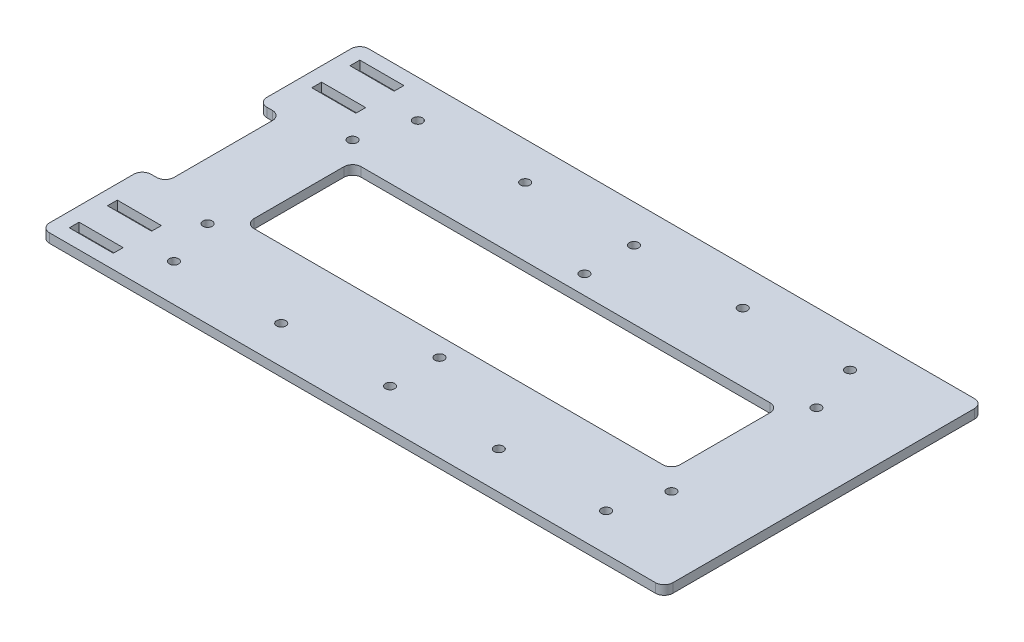
from build123d import *

# Parameters (mm, degrees)
SKETCH1_W           = 215
SKETCH1_H           = 110
BOSS_EXTRUDE1_DEPTH = 3.175
SKETCH2_W           = 147
SKETCH2_H           = 37
CUT_EXTRUDE1_DEPTH  = 121.79458028
SKETCH3_W           = 7.9
SKETCH3_H           = 40
CUT_EXTRUDE2_DEPTH  = 121.79458028
SKETCH5_R           = 1.6
CUT_EXTRUDE4_DEPTH  = 121.79458028
SKETCH6_R           = 1.6
CUT_EXTRUDE5_DEPTH  = 121.79458028
CUT_EXTRUDE6_DEPTH  = 121.79458028
FILLET1_R           = 3


with BuildPart() as part:
    # Sketch1 → Boss-Extrude1 (new body)
    with BuildSketch(Plane(origin=(0, 0, 0), x_dir=(1, 0, 0), z_dir=(0, 1, 0))):
        Rectangle(SKETCH1_W, SKETCH1_H)
    extrude(amount=BOSS_EXTRUDE1_DEPTH)

    # Sketch2 → Cut-Extrude1 (cut, through all)
    with BuildSketch(Plane.XZ):
        Rectangle(SKETCH2_W, SKETCH2_H)
    extrude(amount=-CUT_EXTRUDE1_DEPTH, mode=Mode.SUBTRACT)

    # Sketch3 → Cut-Extrude2 (cut, through all)
    with BuildSketch(Plane(origin=(0, 3.175, 0), x_dir=(1, 0, 0), z_dir=(0, 1, 0))):
        with Locations((-103.55, 0)):
            Rectangle(SKETCH3_W, SKETCH3_H)
    extrude(amount=-CUT_EXTRUDE2_DEPTH, mode=Mode.SUBTRACT)

    # Sketch5 → Cut-Extrude4 (cut, through all)
    with BuildSketch(Plane(origin=(0, 3.175, 0), x_dir=(1, 0, 0), z_dir=(0, 1, 0))):
        with Locations(Location((80, 25, 0), (0, 0, 270))):
            Circle(SKETCH5_R)
        with Locations(Location((80, -25, 0), (0, 0, 270))):
            Circle(SKETCH5_R)
        with Locations(Location((0, 25, 0), (0, 0, 270))):
            Circle(SKETCH5_R)
        with Locations(Location((0, -25, 0), (0, 0, 270))):
            Circle(SKETCH5_R)
        with Locations(Location((-80, 25, 0), (0, 0, 270))):
            Circle(SKETCH5_R)
        with Locations(Location((-80, -25, 0), (0, 0, 270))):
            Circle(SKETCH5_R)
    extrude(amount=-CUT_EXTRUDE4_DEPTH, mode=Mode.SUBTRACT)

    # Sketch6 → Cut-Extrude5 (cut, through all)
    with BuildSketch(Plane(origin=(0, 3.175, 0), x_dir=(1, 0, 0), z_dir=(0, 1, 0))):
        with Locations(Location((-74.528255169, -42.068885296, 0), (0, 0, 270))):
            Circle(SKETCH6_R)
        with Locations(Location((-37.528255169, -42.068885296, 0), (0, 0, 270))):
            Circle(SKETCH6_R)
        with Locations(Location((0, -42.068885296, 0), (0, 0, 270))):
            Circle(SKETCH6_R)
        with Locations(Location((37.528255169, -42.068885296, 0), (0, 0, 90))):
            Circle(SKETCH6_R)
        with Locations(Location((74.528255169, -42.068885296, 0), (0, 0, 90))):
            Circle(SKETCH6_R)
        with Locations(Location((74.528255169, 42.068885296, 0), (0, 0, 270))):
            Circle(SKETCH6_R)
        with Locations(Location((37.528255169, 42.068885296, 0), (0, 0, 270))):
            Circle(SKETCH6_R)
        with Locations(Location((0, 42.068885296, 0), (0, 0, 90))):
            Circle(SKETCH6_R)
        with Locations(Location((-37.528255169, 42.068885296, 0), (0, 0, 90))):
            Circle(SKETCH6_R)
        with Locations(Location((-74.528255169, 42.068885296, 0), (0, 0, 90))):
            Circle(SKETCH6_R)
    extrude(amount=-CUT_EXTRUDE5_DEPTH, mode=Mode.SUBTRACT)

    # Sketch7 → Cut-Extrude6 (cut, through all)
    with BuildSketch(Plane(origin=(0, 3.175, 0), x_dir=(1, 0, 0), z_dir=(0, 1, 0))):
        Polygon((-88.5, 46.725), (-87.4, 46.725), (-87.4, 50.1), (-88.5, 50.1), (-101.5, 50.1), (-102.6, 50.1), (-102.6, 46.725), (-101.5, 46.725), align=None)
        Polygon((-102.6, 33.55), (-101.5, 33.55), (-88.5, 33.55), (-87.4, 33.55), (-87.4, 36.925), (-88.5, 36.925), (-101.5, 36.925), (-102.6, 36.925), align=None)
        Polygon((-88.5, -36.925), (-87.4, -36.925), (-87.4, -33.55), (-88.5, -33.55), (-101.5, -33.55), (-102.6, -33.55), (-102.6, -36.925), (-101.5, -36.925), align=None)
        Polygon((-102.6, -50.1), (-101.5, -50.1), (-88.5, -50.1), (-87.4, -50.1), (-87.4, -46.725), (-88.5, -46.725), (-101.5, -46.725), (-102.6, -46.725), align=None)
    extrude(amount=-CUT_EXTRUDE6_DEPTH, mode=Mode.SUBTRACT)

    # Fillet1
    fillet1_edges = [part.edges().sort_by_distance(p)[0] for p in [
        (-73.5, 1.5875, -18.5),
        (-73.5, 1.5875, 18.5),
        (73.5, 1.5875, 18.5),
        (73.5, 1.5875, -18.5),
        (-99.6, 1.5875, -20),
        (-99.6, 1.5875, 20),
        (-107.5, 1.5875, 20),
        (-107.5, 1.5875, -20),
        (-107.5, 1.5875, -55),
        (107.5, 1.5875, -55),
        (107.5, 1.5875, 55),
        (-107.5, 1.5875, 55),
    ]]
    fillet(fillet1_edges, radius=FILLET1_R)


solid = part.part
